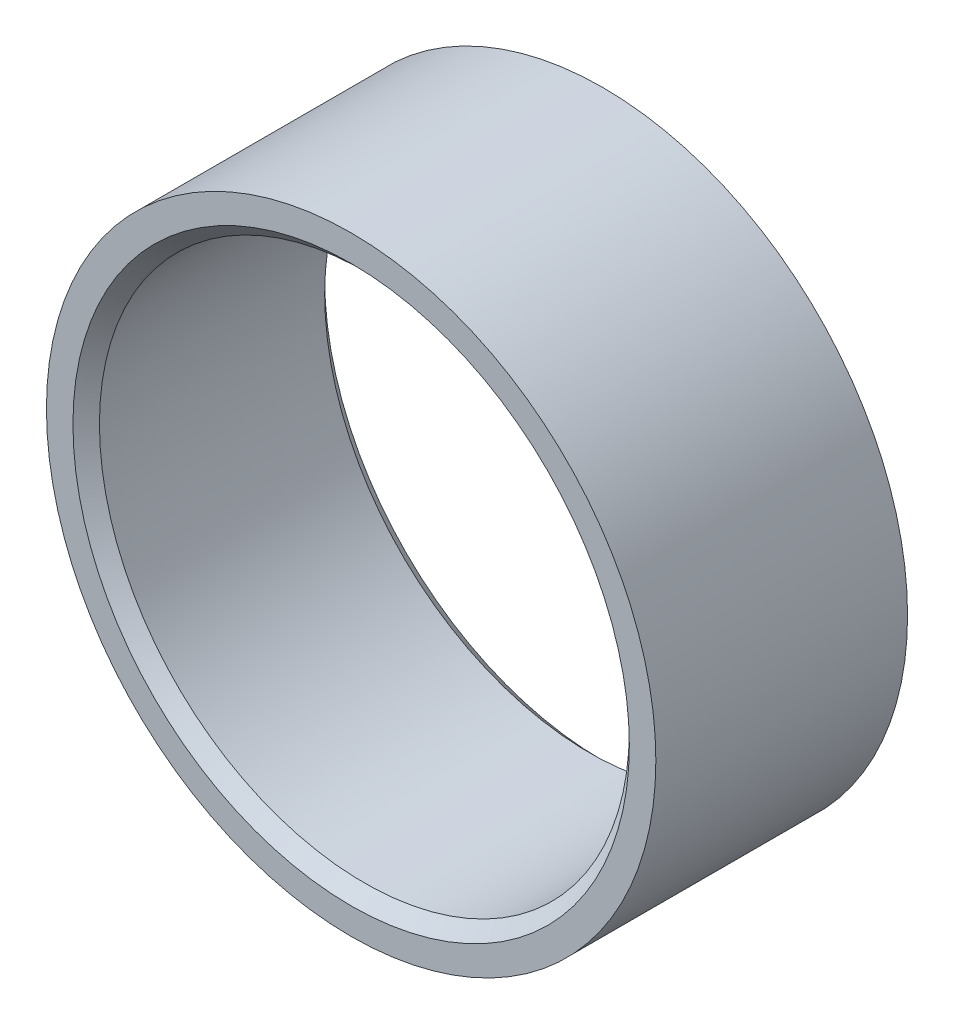
from build123d import *

# Parameters (mm, degrees)
SKETCH_1_R      = 11.5
SKETCH_1_R_2    = 10
EXTRUDE_1_DEPTH = 9.5
CHAMFER_1_SIZE  = 0.5


with BuildPart() as part:
    # 草图1 → 凸台-拉伸1 (new body)
    with BuildSketch(Plane.XY):
        Circle(SKETCH_1_R)
        Circle(SKETCH_1_R_2, mode=Mode.SUBTRACT)
    extrude(amount=EXTRUDE_1_DEPTH)

    # 倒角1
    chamfer_1_edges = [part.edges().sort_by_distance(p)[0] for p in [
        (-10, 0, 0),
        (-10, 0, 9.5),
    ]]
    chamfer(chamfer_1_edges, length=CHAMFER_1_SIZE)


solid = part.part
